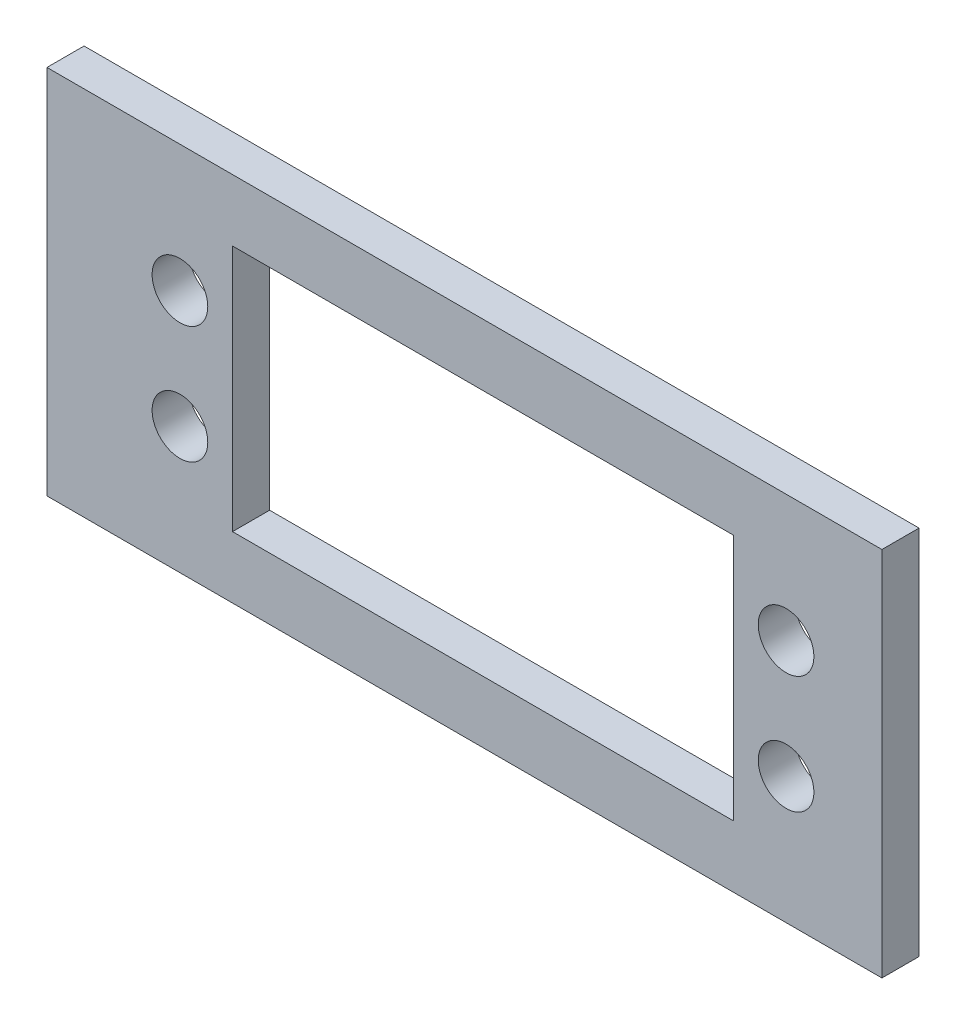
from build123d import *

# Parameters (mm, degrees)
SKETCH1_W           = 67.5
SKETCH1_H           = 30
SKETCH1_R           = 2.25
SKETCH1_W_2         = 40.5
SKETCH1_H_2         = 20
BOSS_EXTRUDE1_DEPTH = 3


with BuildPart() as part:
    # Sketch1 → Boss-Extrude1 (new body)
    with BuildSketch(Plane.XY):
        with Locations((33.75, 15)):
            Rectangle(SKETCH1_W, SKETCH1_H)
        with Locations((10.75, 19.75)):
            Circle(SKETCH1_R, mode=Mode.SUBTRACT)
        with Locations((10.75, 10.25)):
            Circle(SKETCH1_R, mode=Mode.SUBTRACT)
        with Locations((59.75, 19.75)):
            Circle(SKETCH1_R, mode=Mode.SUBTRACT)
        with Locations((59.75, 10.25)):
            Circle(SKETCH1_R, mode=Mode.SUBTRACT)
        with Locations((35.25, 15)):
            Rectangle(SKETCH1_W_2, SKETCH1_H_2, mode=Mode.SUBTRACT)
    extrude(amount=BOSS_EXTRUDE1_DEPTH)


solid = part.part
